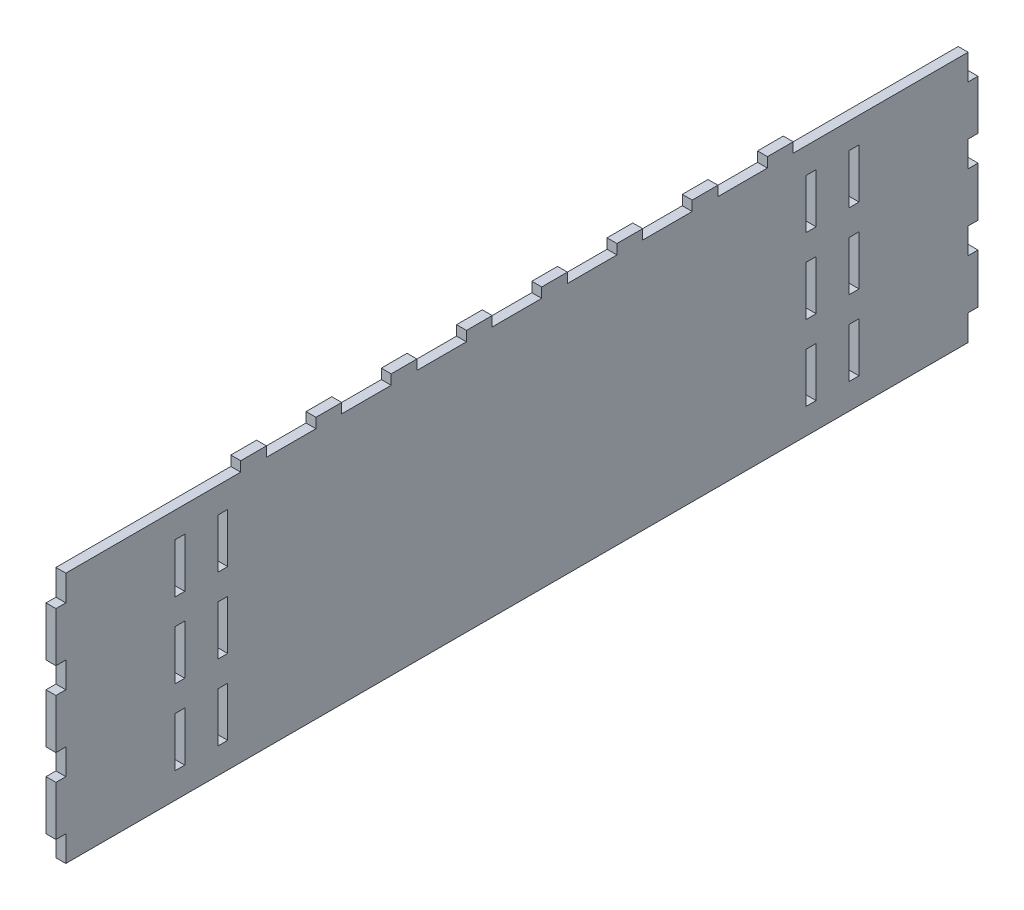
from build123d import *

# Parameters (mm, degrees)
SKETCH1_W                 = 279.4
SKETCH1_H                 = 76.2
BOSS_EXTRUDE1_DEPTH       = 3
SKETCH3_W                 = 3
SKETCH3_H                 = 15
SKETCH3_H_2               = 7.8
CUT_EXTRUDE1_DEPTH        = 145.833352512
LPATTERN1_COUNT           = 4
LPATTERN1_PITCH           = 22.8
MIRROR1_COPY_1_SKETCH_W   = 3
MIRROR1_COPY_1_SKETCH_H   = 15
MIRROR1_COPY_1_SKETCH_H_2 = 7.8
MIRROR1_COPY_1_DEPTH      = 145.833352512
MIRROR1_COPY_2_SKETCH_W   = 3
MIRROR1_COPY_2_SKETCH_H   = 15
MIRROR1_COPY_2_SKETCH_H_2 = 7.8
MIRROR1_COPY_2_DEPTH      = 145.833352512
MIRROR1_COPY_3_SKETCH_W   = 3
MIRROR1_COPY_3_SKETCH_H   = 15
MIRROR1_COPY_3_SKETCH_H_2 = 7.8
MIRROR1_COPY_3_DEPTH      = 145.833352512
SKETCH4_W                 = 3
SKETCH4_H                 = 15
CUT_EXTRUDE2_DEPTH        = 10
LPATTERN2_COUNT           = 3
LPATTERN2_PITCH           = 22.8
MIRROR2_COPY_1_SKETCH_W   = 3
MIRROR2_COPY_1_SKETCH_H   = 15
MIRROR2_COPY_1_DEPTH      = 10
MIRROR2_COPY_2_SKETCH_W   = 3
MIRROR2_COPY_2_SKETCH_H   = 15
MIRROR2_COPY_2_DEPTH      = 10
SKETCH5_W                 = 3
SKETCH5_H                 = 7.8
BOSS_EXTRUDE2_DEPTH       = 3
LPATTERN3_COUNT           = 8
LPATTERN3_PITCH           = 22.8


with BuildPart() as part:
    # Sketch1 → Boss-Extrude1 (new body)
    with BuildSketch(Plane(origin=(0, 0, 0), x_dir=(0, 0, -1), z_dir=(1, 0, 0))):
        Rectangle(SKETCH1_W, SKETCH1_H)
    extrude(amount=-BOSS_EXTRUDE1_DEPTH)

    # Sketch3 → Cut-Extrude1 (cut, through all)
    with BuildSketch(Plane.ZY.offset(3)):
        with Locations((-102.15, 22.8)):
            Rectangle(SKETCH3_W, SKETCH3_H)
        with Locations((-138.2, 34.2)):
            Rectangle(SKETCH3_W, SKETCH3_H_2)
    cut_extrude1 = extrude(amount=-CUT_EXTRUDE1_DEPTH, mode=Mode.SUBTRACT)

    # LPattern1: Cut-Extrude1 ×4
    with Locations(*[(0, -i * LPATTERN1_PITCH, 0) for i in range(1, LPATTERN1_COUNT)]):
        add(cut_extrude1, mode=Mode.SUBTRACT)

    # Mirror1: Cut-Extrude1 across plane
    add(cut_extrude1.mirror(Plane.XY), mode=Mode.SUBTRACT)

    # Mirror1 copy 1 sketch → Mirror1 copy 1 (cut, through all)
    with BuildSketch(Plane(origin=(-3, -22.8, 0), x_dir=(0, 0, -1), z_dir=(-1, 0, 0))):
        with Locations((-102.15, -22.8)):
            Rectangle(MIRROR1_COPY_1_SKETCH_W, MIRROR1_COPY_1_SKETCH_H)
        with Locations((-138.2, -34.2)):
            Rectangle(MIRROR1_COPY_1_SKETCH_W, MIRROR1_COPY_1_SKETCH_H_2)
    extrude(amount=-MIRROR1_COPY_1_DEPTH, mode=Mode.SUBTRACT)

    # Mirror1 copy 2 sketch → Mirror1 copy 2 (cut, through all)
    with BuildSketch(Plane(origin=(-3, -45.6, 0), x_dir=(0, 0, -1), z_dir=(-1, 0, 0))):
        with Locations((-102.15, -22.8)):
            Rectangle(MIRROR1_COPY_2_SKETCH_W, MIRROR1_COPY_2_SKETCH_H)
        with Locations((-138.2, -34.2)):
            Rectangle(MIRROR1_COPY_2_SKETCH_W, MIRROR1_COPY_2_SKETCH_H_2)
    extrude(amount=-MIRROR1_COPY_2_DEPTH, mode=Mode.SUBTRACT)

    # Mirror1 copy 3 sketch → Mirror1 copy 3 (cut, through all)
    with BuildSketch(Plane(origin=(-3, -68.4, 0), x_dir=(0, 0, -1), z_dir=(-1, 0, 0))):
        with Locations((-102.15, -22.8)):
            Rectangle(MIRROR1_COPY_3_SKETCH_W, MIRROR1_COPY_3_SKETCH_H)
        with Locations((-138.2, -34.2)):
            Rectangle(MIRROR1_COPY_3_SKETCH_W, MIRROR1_COPY_3_SKETCH_H_2)
    extrude(amount=-MIRROR1_COPY_3_DEPTH, mode=Mode.SUBTRACT)

    # Sketch4 → Cut-Extrude2 (cut)
    with BuildSketch(Plane(origin=(0, 0, 0), x_dir=(0, 0, -1), z_dir=(1, 0, 0))):
        with Locations((-89.15, 22.8)):
            Rectangle(SKETCH4_W, SKETCH4_H)
    cut_extrude2 = extrude(amount=-CUT_EXTRUDE2_DEPTH, mode=Mode.SUBTRACT)

    # LPattern2: Cut-Extrude2 ×3
    with Locations(*[(0, -i * LPATTERN2_PITCH, 0) for i in range(1, LPATTERN2_COUNT)]):
        add(cut_extrude2, mode=Mode.SUBTRACT)

    # Mirror2: Cut-Extrude2 across plane
    add(cut_extrude2.mirror(Plane.XY), mode=Mode.SUBTRACT)

    # Mirror2 copy 1 sketch → Mirror2 copy 1 (cut)
    with BuildSketch(Plane(origin=(0, -22.8, 0), x_dir=(0, 0, 1), z_dir=(1, 0, 0))):
        with Locations((-89.15, -22.8)):
            Rectangle(MIRROR2_COPY_1_SKETCH_W, MIRROR2_COPY_1_SKETCH_H)
    extrude(amount=-MIRROR2_COPY_1_DEPTH, mode=Mode.SUBTRACT)

    # Mirror2 copy 2 sketch → Mirror2 copy 2 (cut)
    with BuildSketch(Plane(origin=(0, -45.6, 0), x_dir=(0, 0, 1), z_dir=(1, 0, 0))):
        with Locations((-89.15, -22.8)):
            Rectangle(MIRROR2_COPY_2_SKETCH_W, MIRROR2_COPY_2_SKETCH_H)
    extrude(amount=-MIRROR2_COPY_2_DEPTH, mode=Mode.SUBTRACT)

    # Sketch5 → Boss-Extrude2 (add)
    with BuildSketch(Plane(origin=(0, 38.1, 0), x_dir=(1, 0, 0), z_dir=(0, 1, 0))):
        with Locations((-1.5, -79.8)):
            Rectangle(SKETCH5_W, SKETCH5_H)
    boss_extrude2 = extrude(amount=BOSS_EXTRUDE2_DEPTH)

    # LPattern3: Boss-Extrude2 ×8
    with Locations(*[(0, 0, -i * LPATTERN3_PITCH) for i in range(1, LPATTERN3_COUNT)]):
        add(boss_extrude2)


solid = part.part
